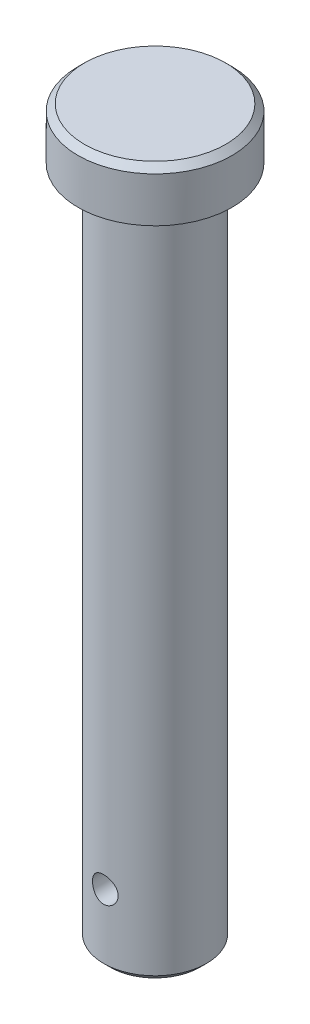
from build123d import *

# Parameters (mm, degrees)
CHAMFER1_SIZE      = 1
CHAMFER2_SIZE      = 1
SKETCH2_R          = 2
CUT_EXTRUDE2_DEPTH = 25


with BuildPart() as part:
    # Sketch1 → Revolve1 (revolve)
    with BuildSketch(Plane.XY, mode=Mode.PRIVATE) as revolve1_sk:
        Polygon((0, -56.5), (0, 56.5), (12, 56.5), (12, 48.5), (8, 48.5), (8, -56.5), align=None)
    revolve(revolve1_sk.sketch.rotate(Axis((0, -56.5, 0), (0, 1, 0)), 90), axis=Axis((0, -56.5, 0), (0, 1, 0)))

    # Chamfer1
    chamfer1_edges = [part.edges().sort_by_distance(p)[0] for p in [
        (0, 56.5, 12),
    ]]
    chamfer(chamfer1_edges, length=CHAMFER1_SIZE)

    # Chamfer2
    chamfer2_edges = [part.edges().sort_by_distance(p)[0] for p in [
        (0, -56.5, 8),
    ]]
    chamfer(chamfer2_edges, length=CHAMFER2_SIZE)

    # Sketch2 → Cut-Extrude2 (cut, symmetric)
    with BuildSketch(Plane.XY):
        with Locations((0, -45.5)):
            Circle(SKETCH2_R)
    extrude(amount=CUT_EXTRUDE2_DEPTH, both=True, mode=Mode.SUBTRACT)


solid = part.part
